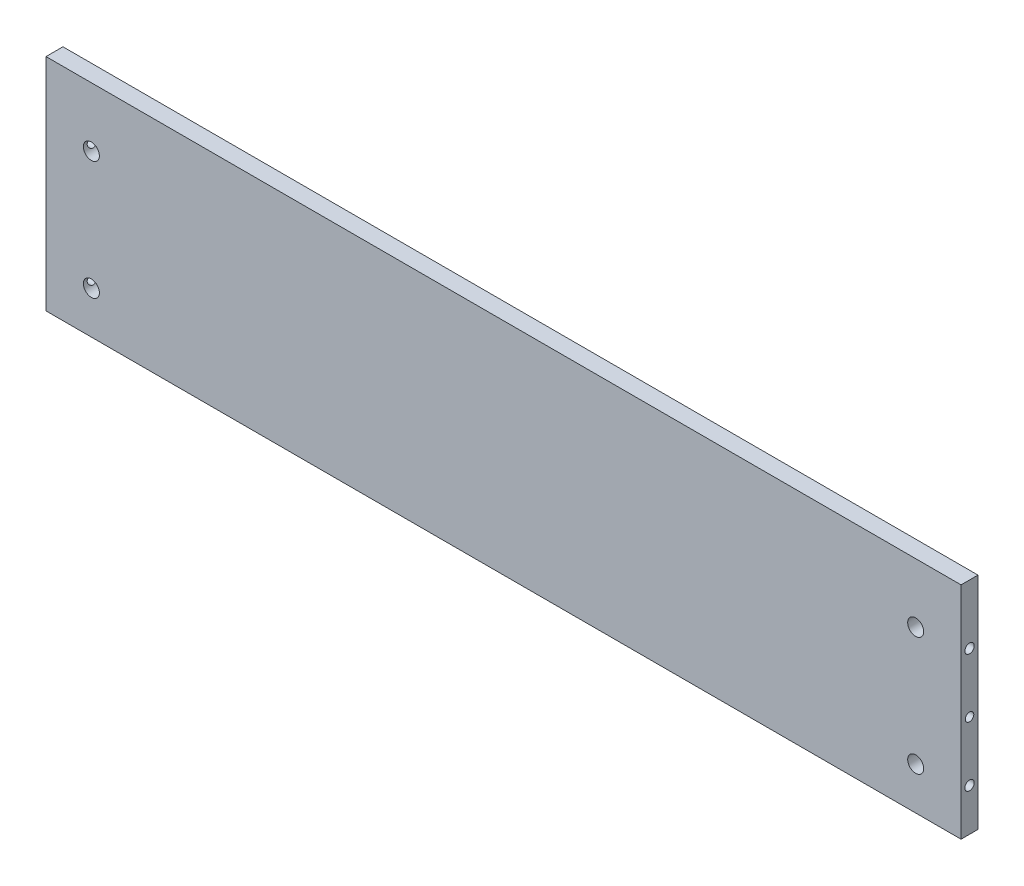
from build123d import *

# Parameters (mm, degrees)
SKETCH1_W           = 685.8
SKETCH1_H           = 165.1
BOSS_EXTRUDE1_DEPTH = 12.7
SKETCH2_R           = 3.175
CUT_EXTRUDE1_DEPTH  = 26.67
SKETCH3_R           = 3.5
CUT_EXTRUDE2_DEPTH  = 34
SKETCH4_R           = 6
CUT_EXTRUDE3_DEPTH  = 9.85
SKETCH5_R           = 1.7526
CUT_EXTRUDE4_DEPTH  = 19.05
SKETCH7_R           = 1.7526
CUT_EXTRUDE5_DEPTH  = 11.43


with BuildPart() as part:
    # Sketch1 → Boss-Extrude1 (new body)
    with BuildSketch(Plane.XY):
        Rectangle(SKETCH1_W, SKETCH1_H)
    extrude(amount=BOSS_EXTRUDE1_DEPTH)

    # Sketch2 → Cut-Extrude1 (cut)
    with BuildSketch(Plane(origin=(342.9, 0, 0), x_dir=(0, 0, -1), z_dir=(1, 0, 0))):
        with Locations((-6.35, -6.35)):
            Circle(SKETCH2_R)
    cut_extrude1 = extrude(amount=-CUT_EXTRUDE1_DEPTH, mode=Mode.SUBTRACT)

    # Sketch3 → Cut-Extrude2 (cut)
    with BuildSketch(Plane(origin=(342.9, 0, 0), x_dir=(0, 0, -1), z_dir=(1, 0, 0))):
        with Locations((-6.35, 38.1)):
            Circle(SKETCH3_R)
        with Locations(Location((-6.35, -50.8, 0), (0, 0, 180))):
            Circle(SKETCH3_R)
    cut_extrude2 = extrude(amount=-CUT_EXTRUDE2_DEPTH, mode=Mode.SUBTRACT)

    # Mirror2: Cut-Extrude1, Cut-Extrude2 across plane
    add(cut_extrude1.mirror(Plane(origin=(0, 0, 0), x_dir=(0, 0, 1), z_dir=(1, 0, 0))), mode=Mode.SUBTRACT)
    add(cut_extrude2.mirror(Plane(origin=(0, 0, 0), x_dir=(0, 0, 1), z_dir=(1, 0, 0))), mode=Mode.SUBTRACT)

    # Sketch4 → Cut-Extrude3 (cut)
    with BuildSketch(Plane.XY.offset(12.7)):
        with Locations((-308.9, 38.1)):
            Circle(SKETCH4_R)
        with Locations((308.9, -50.8)):
            Circle(SKETCH4_R)
        with Locations(Location((-308.9, -50.8, 0), (0, 0, 179.999999983))):
            Circle(SKETCH4_R)
        with Locations((308.9, 38.1)):
            Circle(SKETCH4_R)
    extrude(amount=-CUT_EXTRUDE3_DEPTH, mode=Mode.SUBTRACT)

    # Sketch5 → Cut-Extrude4 (cut)
    with BuildSketch(Plane.XZ.offset(82.55)):
        with Locations(Location((-209.55, 6.35, 0), (0, 0, 270))):
            Circle(SKETCH5_R)
        with Locations(Location((-69.85, 6.35, 0), (0, 0, 270))):
            Circle(SKETCH5_R)
        with Locations(Location((69.85, 6.35, 0), (0, 0, 270))):
            Circle(SKETCH5_R)
        with Locations(Location((209.55, 6.35, 0), (0, 0, 270))):
            Circle(SKETCH5_R)
    extrude(amount=-CUT_EXTRUDE4_DEPTH, mode=Mode.SUBTRACT)

    # Sketch7 → Cut-Extrude5 (cut)
    with BuildSketch(Plane(origin=(0, 0, 0), x_dir=(-1, 0, 0), z_dir=(0, 0, -1))):
        with Locations((278.43375, -61.9125)):
            Circle(SKETCH7_R)
        with Locations(Location((232.39625, -61.9125, 0), (0, 0, 180))):
            Circle(SKETCH7_R)
        with Locations((-232.39625, -61.9125)):
            Circle(SKETCH7_R)
        with Locations(Location((-278.43375, -61.9125, 0), (0, 0, 180))):
            Circle(SKETCH7_R)
    extrude(amount=-CUT_EXTRUDE5_DEPTH, mode=Mode.SUBTRACT)


solid = part.part
